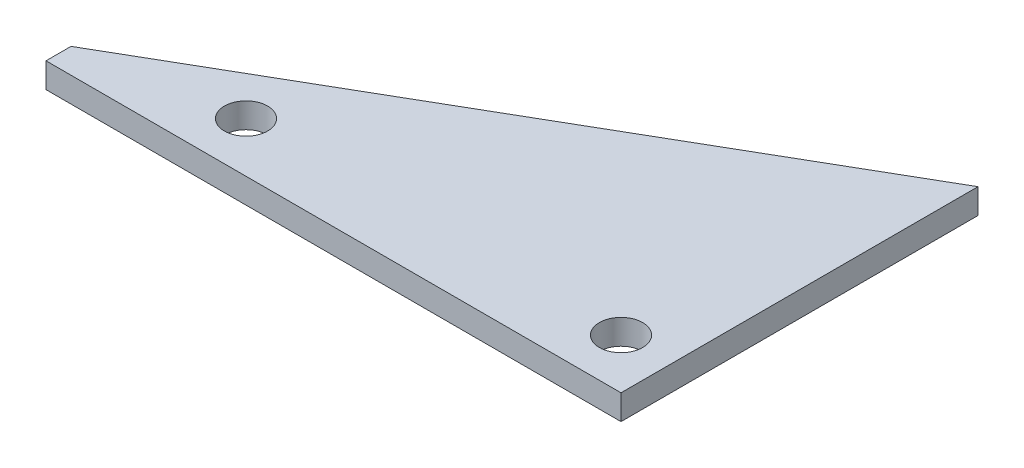
from build123d import *

# Parameters (mm, degrees)
BOSS_EXTRUDE1_DEPTH  = 3.175
M5_CLEARANCE_HOLE1_D = 5.5


with BuildPart() as part:
    # Sketch1 → Boss-Extrude1 (new body)
    with BuildSketch(Plane(origin=(0, 0, 0), x_dir=(1, 0, 0), z_dir=(0, 1, 0))):
        Polygon((0, 0), (73.025, 0), (73.025, 45.336003408), (0, 3.175), align=None)
    extrude(amount=BOSS_EXTRUDE1_DEPTH)

    # M5 Clearance Hole1 (through all)
    with Locations(Plane(origin=(0, 3.175, 0), x_dir=(1, 0, 0), z_dir=(0, 1, 0))):
        with Locations((19.05, 6.35), (66.675, 6.35)):
            Hole(M5_CLEARANCE_HOLE1_D / 2)


solid = part.part
